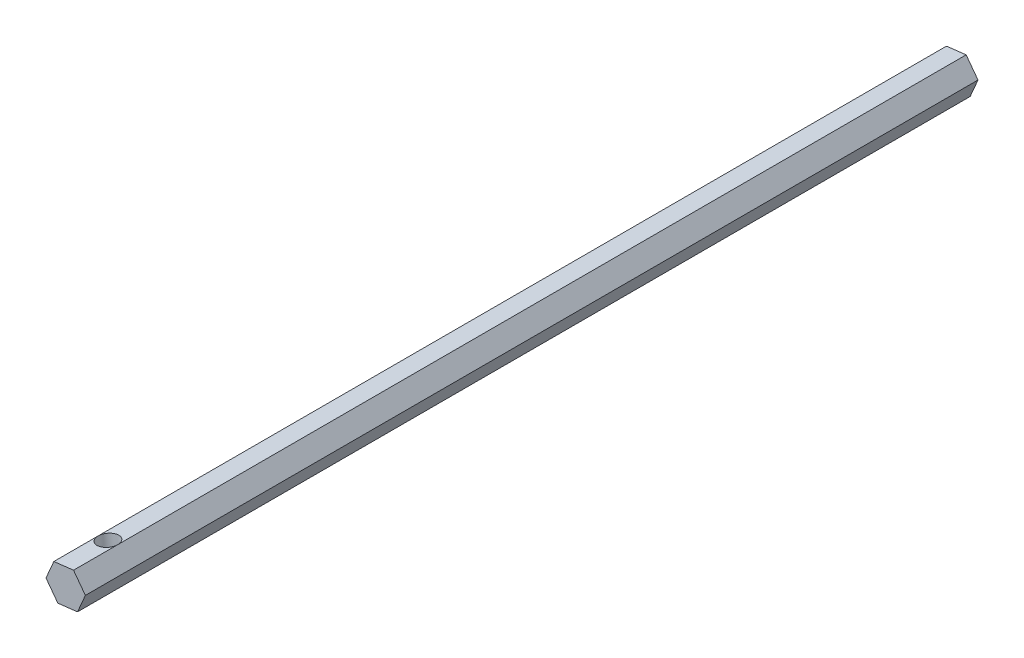
from build123d import *

# Parameters (mm, degrees)
BOSS_EXTRUDE1_DEPTH = 660.4
SKETCH2_RX          = 7.33298
SKETCH2_RY          = 7.27642549
CUT_EXTRUDE1_DEPTH  = 33.02


with BuildPart() as part:
    # Sketch1 → Boss-Extrude1 (new body)
    with BuildSketch(Plane.XY):
        Polygon((5.802204234, 13.469402687), (-8.763742784, 11.759557608), (-14.565947018, -1.709845079), (-5.802204234, -13.469402687), (8.763742784, -11.759557608), (14.565947018, 1.709845079), align=None)
    extrude(amount=BOSS_EXTRUDE1_DEPTH)

    # Sketch2 → Cut-Extrude1 (cut)
    with BuildSketch(Plane(origin=(-1.480769275, 12.614480148, 0), x_dir=(0.9931806044692795, 0.11658596358926146, 0), z_dir=(-0.11658596358926147, 0.9931806044692796, 0))):
        with Locations(Location((0, -627.66702), (0, 0, 180))):
            Ellipse(SKETCH2_RX, SKETCH2_RY)
    extrude(amount=-CUT_EXTRUDE1_DEPTH, mode=Mode.SUBTRACT)


solid = part.part
